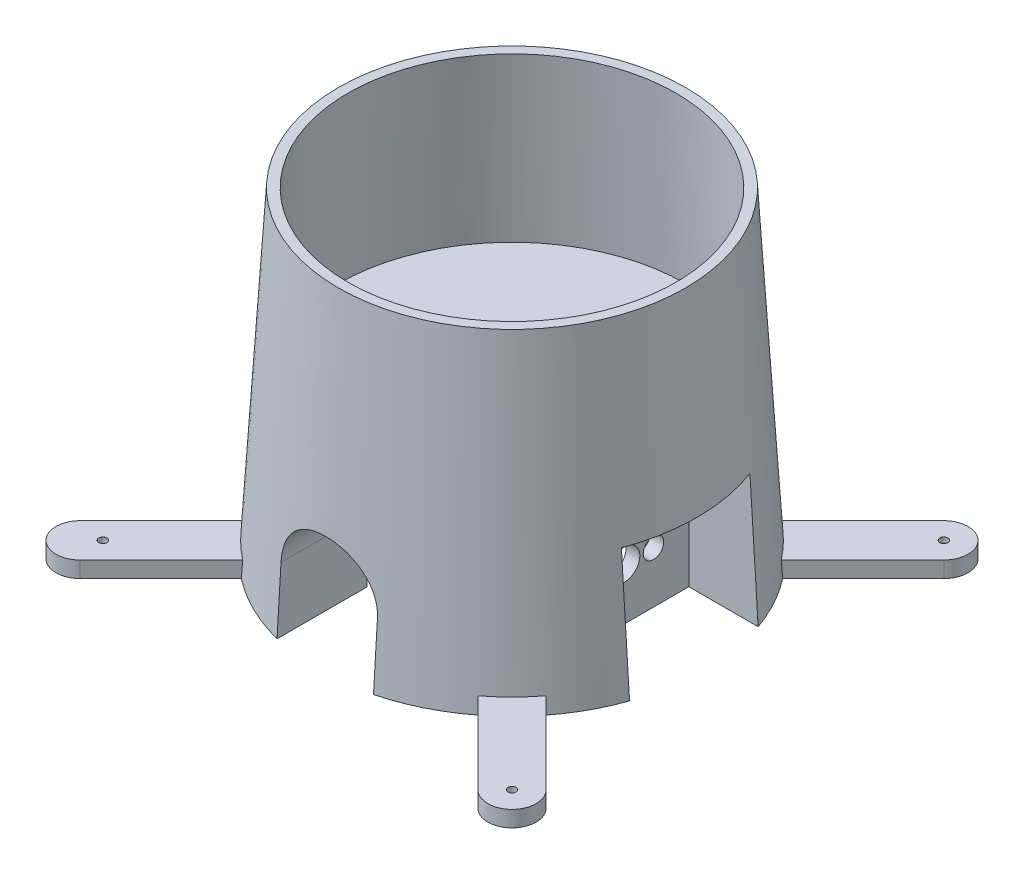
from build123d import *

# Parameters (mm, degrees)
SKETCH_5_W                          = 61.5
SKETCH_5_H                          = 60.2
CUT_EXTRUDE_1_DEPTH                 = 40
CUT_EXTRUDE_START                   = -35
SKETCH_6_W                          = 40
SKETCH_6_H                          = 40
CUT_EXTRUDE_2_DEPTH                 = 35
CUT_EXTRUDE_START_2                 = 35
SKETCH_9_W                          = 40
SKETCH_9_H                          = 40
CUT_EXTRUDE_3_DEPTH                 = 40
CUT_EXTRUDE_4_DEPTH                 = 40
F_2_5MM_1_D                         = 2.5
F_2_5MM_1_CSINK_D                   = 2.55
F_2_5MM_1_CSINK_ANGLE               = 90
CUT_EXTRUDE_START_3                 = -10
CUT_EXTRUDE_5_DEPTH                 = 10
HOLE_WIZARD_3_8_0_375_1_D           = 9.525
HOLE_WIZARD_3_8_0_375_1_CSINK_D     = 10.795
HOLE_WIZARD_3_8_0_375_1_CSINK_ANGLE = 90
HOLE_WIZARD_1_4_0_25_1_D            = 6.35
HOLE_WIZARD_1_4_0_25_1_CSINK_D      = 7.62
HOLE_WIZARD_1_4_0_25_1_CSINK_ANGLE  = 90
EXTRUDE_1_DEPTH                     = 5
F_2_5MM_2_D                         = 2.5
F_2_5MM_2_CSINK_D                   = 2.55
F_2_5MM_2_CSINK_ANGLE               = 90


with BuildPart() as part:
    # 草图3 → 旋转2 (revolve)
    with BuildSketch(Plane(origin=(0, 0, 0), x_dir=(0, 0, -1), z_dir=(1, 0, 0)), mode=Mode.PRIVATE) as revolve_2_sk:
        Polygon((0, 0), (60, 0), (54, 100), (0, 100), align=None)
    revolve(revolve_2_sk.sketch.rotate(Axis((0, 100, 0), (0, -1, 0)), 180), axis=Axis((0, 100, 0), (0, -1, 0)))

    # 草图5 → 切除-拉伸1 (cut)
    with BuildSketch(Plane(origin=(0, 0, 0), x_dir=(-1, 0, 0), z_dir=(0, -1, 0))):
        Rectangle(SKETCH_5_W, SKETCH_5_H)
    extrude(amount=-CUT_EXTRUDE_1_DEPTH, mode=Mode.SUBTRACT)

    # 草图6 → 切除-拉伸2 (cut)
    with BuildSketch(Plane(origin=(0, 0, 0), x_dir=(0, 0, -1), z_dir=(1, 0, 0)).offset(CUT_EXTRUDE_START)):
        with Locations((0, 20)):
            Rectangle(SKETCH_6_W, SKETCH_6_H)
    extrude(amount=-CUT_EXTRUDE_2_DEPTH, mode=Mode.SUBTRACT)

    # 草图9 → 切除-拉伸3 (cut)
    with BuildSketch(Plane(origin=(0, 0, 0), x_dir=(0, 0, -1), z_dir=(1, 0, 0)).offset(CUT_EXTRUDE_START_2)):
        with Locations((0, 20)):
            Rectangle(SKETCH_9_W, SKETCH_9_H)
    extrude(amount=CUT_EXTRUDE_3_DEPTH, mode=Mode.SUBTRACT)

    # 草图10 → 切除-拉伸4 (cut)
    with BuildSketch(Plane(origin=(0, 0, 30.1), x_dir=(-1, 0, 0), z_dir=(0, 0, -1))):
        with BuildLine():
            Line((-15, 0), (-15, 20))
            ThreePointArc((-15, 20), (0, 35), (15, 20))
            Line((15, 20), (15, 0))
            Line((15, 0), (-15, 0))
        make_face()
    extrude(amount=-CUT_EXTRUDE_4_DEPTH, mode=Mode.SUBTRACT)

    # 草图11 → 切除-旋转1 (revolve, cut)
    with BuildSketch(Plane.XY, mode=Mode.PRIVATE) as cut_revolve_1_sk:
        Polygon((-50.994604851, 100), (-54.174604851, 47), (0, 47), (0, 100), align=None)
    revolve(cut_revolve_1_sk.sketch.rotate(Axis((0, 47, 0), (0, 1, 0)), 200.317507635), axis=Axis((0, 47, 0), (0, 1, 0)), mode=Mode.SUBTRACT)

    # Ø2.5mm 暗销孔1 (through all)
    with Locations(Plane(origin=(0, 47, 0), x_dir=(1, 0, 0), z_dir=(0, 1, 0))):
        with Locations((41.5, -13.5), (-10.5, 13.5), (-10.5, -13.5), (41.5, 13.5)):
            CounterSinkHole(F_2_5MM_1_D / 2, F_2_5MM_1_CSINK_D / 2, counter_sink_angle=F_2_5MM_1_CSINK_ANGLE)

    # 草图16 → 切除-拉伸5 (cut)
    with BuildSketch(Plane.XY.offset(-30.1).offset(CUT_EXTRUDE_START_3)):
        with BuildLine():
            Line((15, 20), (15, 0))
            Line((15, 0), (-15, 0))
            Line((-15, 0), (-15, 20))
            ThreePointArc((-15, 20), (0, 35), (15, 20))
        make_face()
    extrude(amount=CUT_EXTRUDE_5_DEPTH, mode=Mode.SUBTRACT)

    # 3/8 (0.375) 直径孔1 (through all)
    with Locations(Plane.ZY.offset(35)):
        with Locations((0, 16)):
            CounterSinkHole(HOLE_WIZARD_3_8_0_375_1_D / 2, HOLE_WIZARD_3_8_0_375_1_CSINK_D / 2, counter_sink_angle=HOLE_WIZARD_3_8_0_375_1_CSINK_ANGLE)

    # 1/4 (0.25) 直径孔1 (through all)
    with Locations(Plane.ZY.offset(35)):
        with Locations((9, 16), (-9, 16)):
            CounterSinkHole(HOLE_WIZARD_1_4_0_25_1_D / 2, HOLE_WIZARD_1_4_0_25_1_CSINK_D / 2, counter_sink_angle=HOLE_WIZARD_1_4_0_25_1_CSINK_ANGLE)

    # 草图21 → 凸台-拉伸1 (add)
    with BuildSketch(Plane.XZ):
        with BuildLine():
            Line((-40.658639918, 30.0520382), (-72.478445072, 61.871843354))
            ThreePointArc((-72.478445072, 61.871843354), (-72.478445072, 72.478445072), (-61.871843354, 72.478445072))
            Line((-61.871843354, 72.478445072), (-30.0520382, 40.658639918))
            Line((-30.0520382, 40.658639918), (-40.658639918, 30.0520382))
        make_face()
        with BuildLine():
            Line((40.658639918, 30.0520382), (72.478445072, 61.871843354))
            ThreePointArc((72.478445072, 61.871843354), (72.478445072, 72.478445072), (61.871843354, 72.478445072))
            Line((61.871843354, 72.478445072), (30.0520382, 40.658639918))
            Line((30.0520382, 40.658639918), (40.658639918, 30.0520382))
        make_face()
        with BuildLine():
            Line((30.0520382, -40.658639918), (61.871843354, -72.478445072))
            ThreePointArc((61.871843354, -72.478445072), (72.478445072, -72.478445072), (72.478445072, -61.871843354))
            Line((72.478445072, -61.871843354), (40.658639918, -30.0520382))
            Line((40.658639918, -30.0520382), (30.0520382, -40.658639918))
        make_face()
        with BuildLine():
            Line((-40.658639918, -30.0520382), (-72.478445072, -61.871843354))
            ThreePointArc((-72.478445072, -61.871843354), (-72.478445072, -72.478445072), (-61.871843354, -72.478445072))
            Line((-61.871843354, -72.478445072), (-30.0520382, -40.658639918))
            Line((-30.0520382, -40.658639918), (-40.658639918, -30.0520382))
        make_face()
    extrude(amount=-EXTRUDE_1_DEPTH)

    # Ø2.5mm 暗销孔2 (through all)
    with Locations(Plane(origin=(0, 5, 0), x_dir=(1, 0, 0), z_dir=(0, 1, 0))):
        with Locations((-67.175144213, 67.175144213), (67.175144213, 67.175144213), (67.175144213, -67.175144213), (-63.639610307, -63.639610307)):
            CounterSinkHole(F_2_5MM_2_D / 2, F_2_5MM_2_CSINK_D / 2, counter_sink_angle=F_2_5MM_2_CSINK_ANGLE)


solid = part.part
